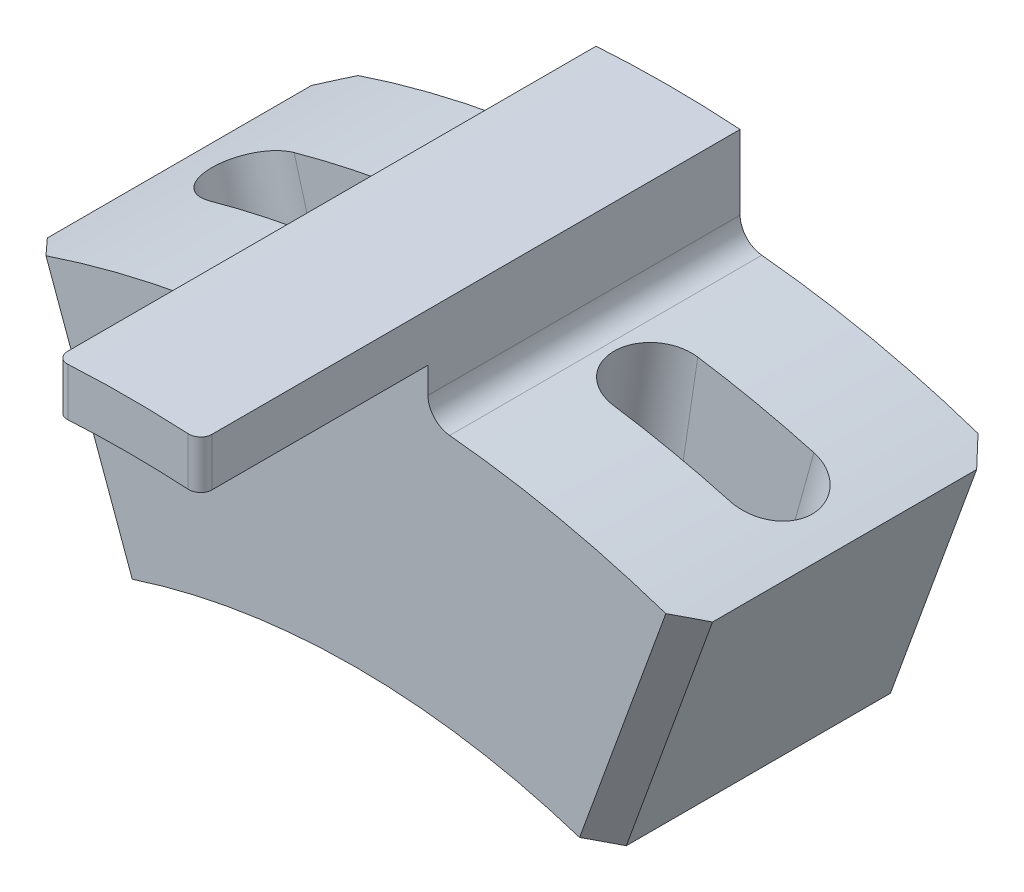
from build123d import *

# Parameters (mm, degrees)
EXTRUDE_1_DEPTH          = 6.5
EXTRUDE_START            = 9.5
EXTRUDE_2_DEPTH          = 9.5
PATTERN_CIRCULAR_1_COUNT = 2
PATTERN_CIRCULAR_1_ANGLE = 7
CUT_EXTRUDE_2_DEPTH      = 1.75
FILLET_1_R               = 1
CHAMFER_1_SIZE           = 1
FILLET_2_R               = 0.5


with BuildPart() as part:
    # Эскиз1 → Бобышка-Вытянуть1 (new, symmetric)
    with BuildSketch(Plane.XY):
        with BuildLine():
            Line((10.2606043, 28.190778624), (13.851815805, 38.057551142))
            ThreePointArc((13.851815805, 38.057551142), (8.506146587, 39.596659837), (3, 40.388736054))
            Line((3, 40.388736054), (3, 44.398761244))
            ThreePointArc((3, 44.398761244), (0, 44.5), (-3, 44.398761244))
            Line((-3, 44.398761244), (-3, 40.388736054))
            ThreePointArc((-3, 40.388736054), (-8.506146587, 39.596659837), (-13.851815805, 38.057551142))
            Line((-13.851815805, 38.057551142), (-10.2606043, 28.190778624))
            ThreePointArc((-10.2606043, 28.190778624), (0, 30), (10.2606043, 28.190778624))
        make_face()
    extrude(amount=EXTRUDE_1_DEPTH, both=True)

    # Эскиз2 → Бобышка-Вытянуть2 (add)
    with BuildSketch(Plane.XY.offset(6.5).offset(EXTRUDE_START)):
        with BuildLine():
            Line((3, 42.393985422), (3, 44.398761244))
            ThreePointArc((3, 44.398761244), (0, 44.5), (-3, 44.398761244))
            Line((-3, 44.398761244), (-3, 42.393985422))
            ThreePointArc((-3, 42.393985422), (0, 42.5), (3, 42.393985422))
        make_face()
    extrude(amount=-EXTRUDE_2_DEPTH)

    # Эскиз4 → Вырез-Повернуть1 (revolve, cut)
    with BuildSketch(Plane.XY):
        Polygon((13.712080217, 42.895703236), (8.367312695, 23.623094172), (6.680959402, 24.09076133), (12.025726924, 43.363370394), align=None)
    cut_revolve_1 = revolve(axis=Axis((0, 0, 0), (0.2672383760782574, 0.9636304532086228, 0)), mode=Mode.SUBTRACT)

    # Круговой массив1: Вырез-Повернуть1 ×2 about axis
    pattern_circular_1_axis = Axis((0, 0, 6.5), (0, 0, 1))
    for i in range(1, PATTERN_CIRCULAR_1_COUNT):
        add(cut_revolve_1.rotate(pattern_circular_1_axis, i * PATTERN_CIRCULAR_1_ANGLE / (PATTERN_CIRCULAR_1_COUNT - 1)), mode=Mode.SUBTRACT)

    # Эскиз6 → Вырез-Вытянуть2 (cut, symmetric)
    with BuildSketch(Plane.XY):
        with BuildLine():
            Line((4.434282334, 29.670475901), (5.986281151, 40.055142466))
            ThreePointArc((5.986281151, 40.055142466), (8.420423478, 39.61497783), (10.823154231, 39.027033355))
            Line((10.823154231, 39.027033355), (8.017151282, 28.908913596))
            ThreePointArc((8.017151282, 28.908913596), (6.237350725, 29.344428022), (4.434282334, 29.670475901))
        make_face()
    cut_extrude_2 = extrude(amount=CUT_EXTRUDE_2_DEPTH, both=True, mode=Mode.SUBTRACT)

    # Зеркальное отражение1: Вырез-Повернуть1, Вырез-Вытянуть2 across plane
    add(cut_revolve_1.mirror(Plane(origin=(0, 0, 0), x_dir=(0, 0, 1), z_dir=(1, 0, 0))), mode=Mode.SUBTRACT)
    add(cut_extrude_2.mirror(Plane(origin=(0, 0, 0), x_dir=(0, 0, 1), z_dir=(1, 0, 0))), mode=Mode.SUBTRACT)

    # Зеркальное отражение1 copy 1 sketch → Зеркальное отражение1 copy 1 (revolve, cut)
    with BuildSketch(Plane(origin=(0, 0, 0), x_dir=(-0.992546151641322, 0.12186934340514775, 0), z_dir=(0, 0, 1))):
        Polygon((13.712080217, -42.895703236), (8.367312695, -23.623094172), (6.680959402, -24.09076133), (12.025726924, -43.363370394), align=None)
    revolve(axis=Axis((0, 0, 0), (0.14780941112961088, -0.9890158633619167, 0)), mode=Mode.SUBTRACT)

    # Скругление1
    fillet_1_edges = [part.edges().sort_by_distance(p)[0] for p in [
        (-3, 40.388736054, 0),
        (3, 40.388736054, 0),
    ]]
    fillet(fillet_1_edges, radius=FILLET_1_R)

    # Фаска1
    chamfer_1_edges = [part.edges().sort_by_distance(p)[0] for p in [
        (12.056210052, 33.124164883, -6.5),
        (-12.056210052, 33.124164883, 6.5),
        (-12.056210052, 33.124164883, -6.5),
        (12.056210052, 33.124164883, 6.5),
    ]]
    chamfer(chamfer_1_edges, length=CHAMFER_1_SIZE)

    # Скругление2
    fillet_2_edges = [part.edges().sort_by_distance(p)[0] for p in [
        (-3, 43.396373333, 16),
        (3, 43.396373333, 16),
    ]]
    fillet(fillet_2_edges, radius=FILLET_2_R)


solid = part.part
